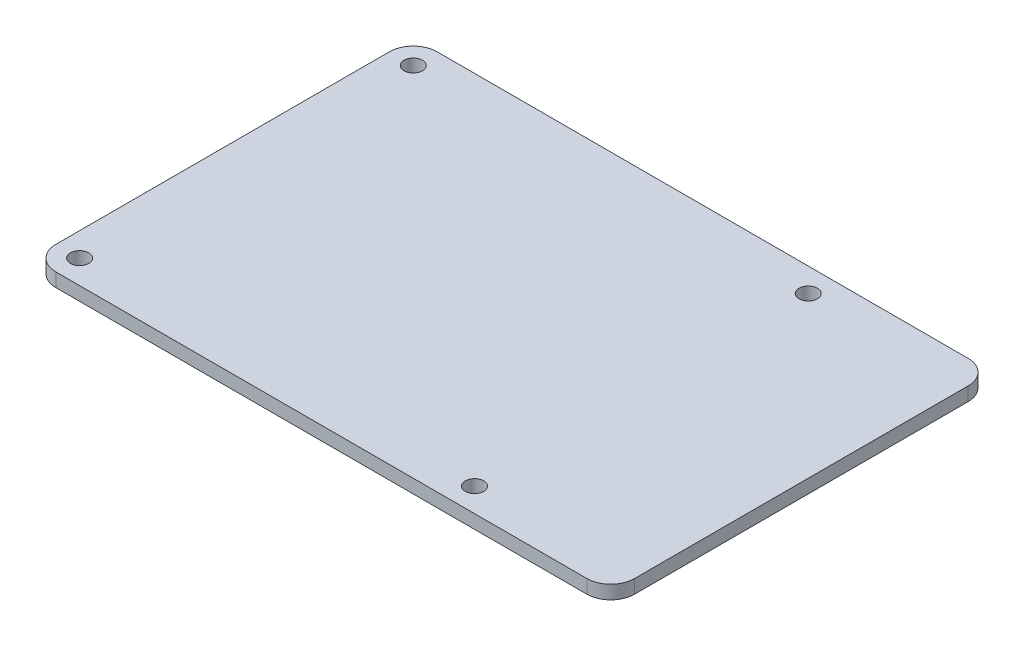
from build123d import *

# Parameters (mm, degrees)
SKETCH_1_W          = 85
SKETCH_1_H          = 56
EXTRUDE_1_DEPTH     = 2
SKETCH_2_R          = 1.35
CUT_EXTRUDE_1_DEPTH = 2
FILLET_1_R          = 3.5


with BuildPart() as part:
    # 草图1 → 凸台-拉伸1 (new body)
    with BuildSketch(Plane(origin=(0, 0, 0), x_dir=(1, 0, 0), z_dir=(0, 1, 0))):
        Rectangle(SKETCH_1_W, SKETCH_1_H)
    extrude(amount=EXTRUDE_1_DEPTH)

    # 草图2 → 切除-拉伸1 (cut)
    with BuildSketch(Plane(origin=(0, 2, 0), x_dir=(1, 0, 0), z_dir=(0, 1, 0))):
        with Locations(Location((-39, 24.5, 0), (0, 0, 270))):
            Circle(SKETCH_2_R)
        with Locations(Location((19, 24.5, 0), (0, 0, 270))):
            Circle(SKETCH_2_R)
        with Locations(Location((-39, -24.5, 0), (0, 0, 270))):
            Circle(SKETCH_2_R)
        with Locations(Location((19, -24.5, 0), (0, 0, 270))):
            Circle(SKETCH_2_R)
    extrude(amount=-CUT_EXTRUDE_1_DEPTH, mode=Mode.SUBTRACT)

    # 圆角1
    fillet_1_edges = [part.edges().sort_by_distance(p)[0] for p in [
        (42.5, 1, 28),
        (-42.5, 1, 28),
        (-42.5, 1, -28),
        (42.5, 1, -28),
    ]]
    fillet(fillet_1_edges, radius=FILLET_1_R)


solid = part.part
